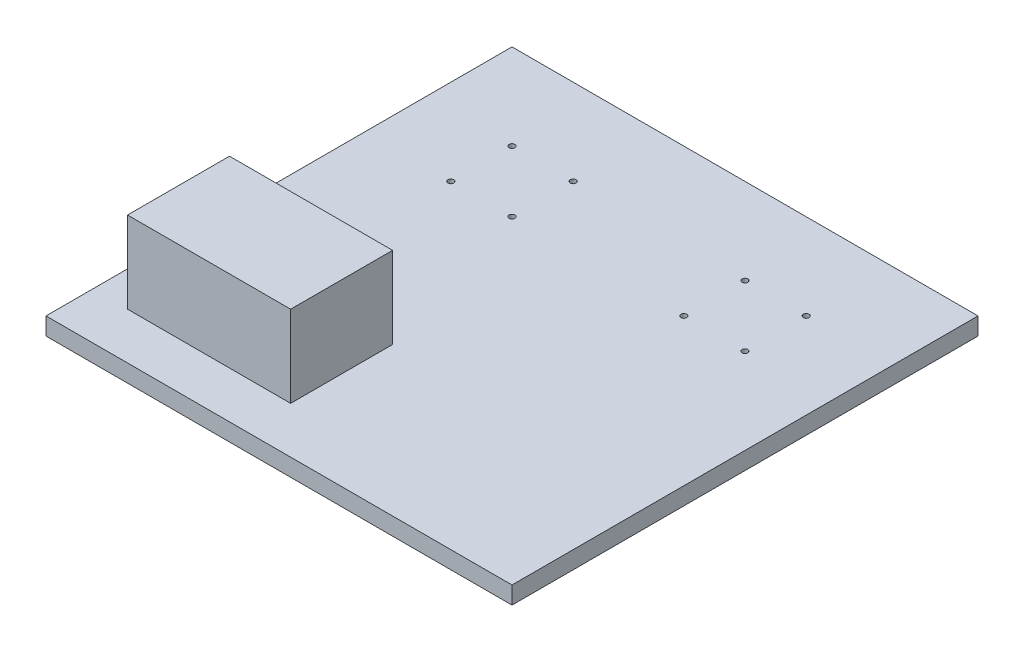
from build123d import *

# Parameters (mm, degrees)
SKETCH_1_W          = 80
SKETCH_1_H          = 80
EXTRUDE_1_DEPTH     = 6
SKETCH_2_R          = 1
CUT_EXTRUDE_1_DEPTH = 57.885850613
SKETCH_3_W          = 80
SKETCH_3_H          = 6
EXTRUDE_2_DEPTH     = 80
SKETCH_4_W          = 56
SKETCH_4_H          = 35
EXTRUDE_3_DEPTH     = 28
SKETCH_5_W          = 48
SKETCH_5_H          = 24
CUT_EXTRUDE_2_DEPTH = 31


with BuildPart() as part:
    # ｽｹｯﾁ1 → ﾎﾞｽ - 押し出し1 (new body)
    with BuildSketch(Plane(origin=(0, 0, 0), x_dir=(1, 0, 0), z_dir=(0, 1, 0))):
        Rectangle(SKETCH_1_W, SKETCH_1_H)
    extrude_1 = extrude(amount=EXTRUDE_1_DEPTH)

    # ｽｹｯﾁ2 → ｶｯﾄ - 押し出し1 (cut, through all)
    with BuildSketch(Plane(origin=(0, 6, 0), x_dir=(1, 0, 0), z_dir=(0, 1, 0))):
        with Locations(Location((-10.5, 10.5, 0), (0, 0, 270))):
            Circle(SKETCH_2_R)
        with Locations(Location((10.5, 10.5, 0), (0, 0, 270))):
            Circle(SKETCH_2_R)
        with Locations(Location((10.5, -10.5, 0), (0, 0, 270))):
            Circle(SKETCH_2_R)
        with Locations(Location((-10.5, -10.5, 0), (0, 0, 270))):
            Circle(SKETCH_2_R)
    cut_extrude_1 = extrude(amount=-CUT_EXTRUDE_1_DEPTH, mode=Mode.SUBTRACT)

    # ﾐﾗｰ9: ﾎﾞｽ - 押し出し1, ｶｯﾄ - 押し出し1 across plane
    add(extrude_1.mirror(Plane(origin=(40, 6, -40), x_dir=(0, 0, 1), z_dir=(-1, 0, 0))))
    add(cut_extrude_1.mirror(Plane(origin=(40, 6, -40), x_dir=(0, 0, 1), z_dir=(-1, 0, 0))), mode=Mode.SUBTRACT)

    # ﾐﾗｰ10: ﾎﾞｽ - 押し出し1 across plane
    add(extrude_1.mirror(Plane(origin=(-40, 6, 40), x_dir=(1, 0, 0), z_dir=(0, 0, -1))))

    # ｽｹｯﾁ3 → ﾎﾞｽ - 押し出し2 (add)
    with BuildSketch(Plane(origin=(40, 0, 0), x_dir=(0, 0, -1), z_dir=(1, 0, 0))):
        with Locations((-80, 3)):
            Rectangle(SKETCH_3_W, SKETCH_3_H)
    extrude(amount=EXTRUDE_2_DEPTH)

    # ｽｹｯﾁ4 → ﾎﾞｽ - 押し出し3 (add)
    with BuildSketch(Plane(origin=(0, 6, 0), x_dir=(1, 0, 0), z_dir=(0, 1, 0))):
        with Locations((0, -86.5)):
            Rectangle(SKETCH_4_W, SKETCH_4_H)
    extrude(amount=EXTRUDE_3_DEPTH)

    # ｽｹｯﾁ5 → ｶｯﾄ - 押し出し2 (cut)
    with BuildSketch(Plane(origin=(0, 0, 69), x_dir=(-1, 0, 0), z_dir=(0, 0, -1))):
        with Locations((0, 18)):
            Rectangle(SKETCH_5_W, SKETCH_5_H)
    extrude(amount=-CUT_EXTRUDE_2_DEPTH, mode=Mode.SUBTRACT)


solid = part.part
